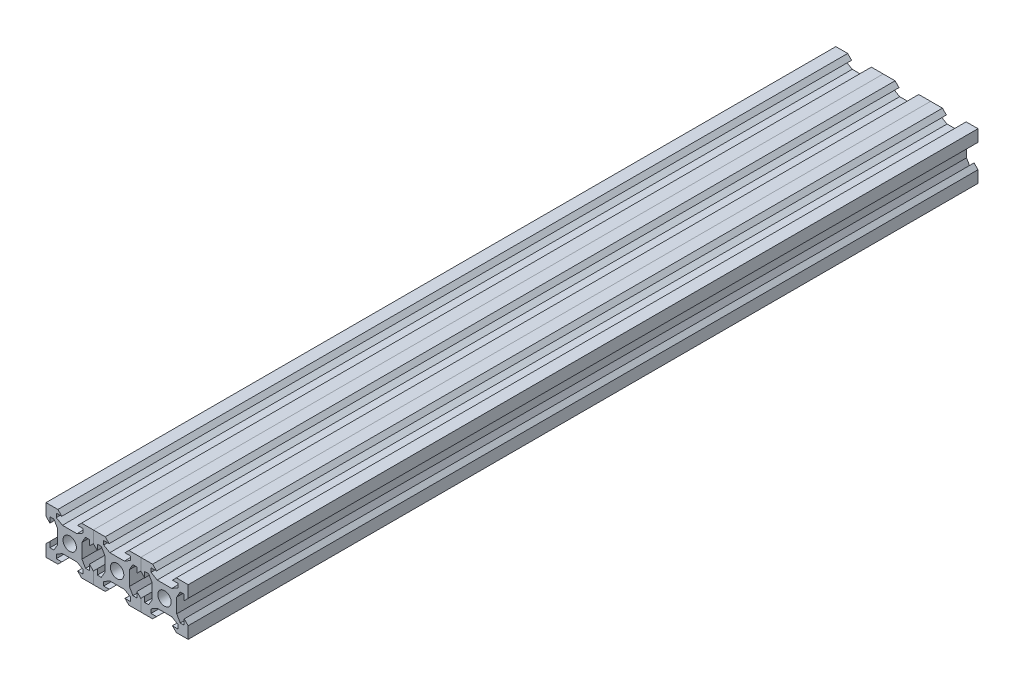
from build123d import *

# Parameters (mm, degrees)
SKETCH1_R           = 4.25
BOSS_EXTRUDE1_DEPTH = 250


with BuildPart() as part:
    # Sketch1 → Boss-Extrude1 (new, symmetric)
    with BuildSketch(Plane.XY):
        Polygon((45, 7.5), (45, 15), (37.5, 15), (35, 12.5), (38.5, 12.5), (38.5, 10), (34.602885683, 7.75), (25.397114317, 7.75), (21.5, 10), (21.5, 12.5), (25, 12.5), (22.5, 15), (7.5, 15), (5, 12.5), (8.5, 12.5), (8.5, 10), (4.602885683, 7.75), (-4.602885683, 7.75), (-8.5, 10), (-8.5, 12.5), (-5, 12.5), (-7.5, 15), (-22.5, 15), (-25, 12.5), (-21.5, 12.5), (-21.5, 10), (-25.397114317, 7.75), (-34.602885683, 7.75), (-38.5, 10), (-38.5, 12.5), (-35, 12.5), (-37.5, 15), (-45, 15), (-45, 7.5), (-42.5, 5), (-42.5, 8.5), (-40, 8.5), (-37.75, 4.602885683), (-37.75, -4.602885683), (-40, -8.5), (-42.5, -8.5), (-42.5, -5), (-45, -7.5), (-45, -15), (-37.5, -15), (-35, -12.5), (-38.5, -12.5), (-38.5, -10), (-34.602885683, -7.75), (-25.397114317, -7.75), (-21.5, -10), (-21.5, -12.5), (-25, -12.5), (-22.5, -15), (-7.5, -15), (-5, -12.5), (-8.5, -12.5), (-8.5, -10), (-4.602885683, -7.75), (4.602885683, -7.75), (8.5, -10), (8.5, -12.5), (5, -12.5), (7.5, -15), (22.5, -15), (25, -12.5), (21.5, -12.5), (21.5, -10), (25.397114317, -7.75), (34.602885683, -7.75), (38.5, -10), (38.5, -12.5), (35, -12.5), (37.5, -15), (45, -15), (45, -7.5), (42.5, -5), (42.5, -8.5), (40, -8.5), (37.75, -4.602885683), (37.75, 4.602885683), (40, 8.5), (42.5, 8.5), (42.5, 5), align=None)
        with Locations((-30, 0)):
            Circle(SKETCH1_R, mode=Mode.SUBTRACT)
        Polygon((-17.5, 8.5), (-17.5, 5), (-15, 7.5), (-12.5, 5), (-12.5, 8.5), (-10, 8.5), (-7.75, 4.602885683), (-7.75, -4.602885683), (-10, -8.5), (-12.5, -8.5), (-12.5, -5), (-15, -7.5), (-17.5, -5), (-17.5, -8.5), (-20, -8.5), (-22.25, -4.602885683), (-22.25, 4.602885683), (-20, 8.5), align=None, mode=Mode.SUBTRACT)
        Circle(SKETCH1_R, mode=Mode.SUBTRACT)
        Polygon((15, 7.5), (17.5, 5), (17.5, 8.5), (20, 8.5), (22.25, 4.602885683), (22.25, -4.602885683), (20, -8.5), (17.5, -8.5), (17.5, -5), (15, -7.5), (12.5, -5), (12.5, -8.5), (10, -8.5), (7.75, -4.602885683), (7.75, 4.602885683), (10, 8.5), (12.5, 8.5), (12.5, 5), align=None, mode=Mode.SUBTRACT)
        with Locations((30, 0)):
            Circle(SKETCH1_R, mode=Mode.SUBTRACT)
    extrude(amount=BOSS_EXTRUDE1_DEPTH, both=True)


solid = part.part
